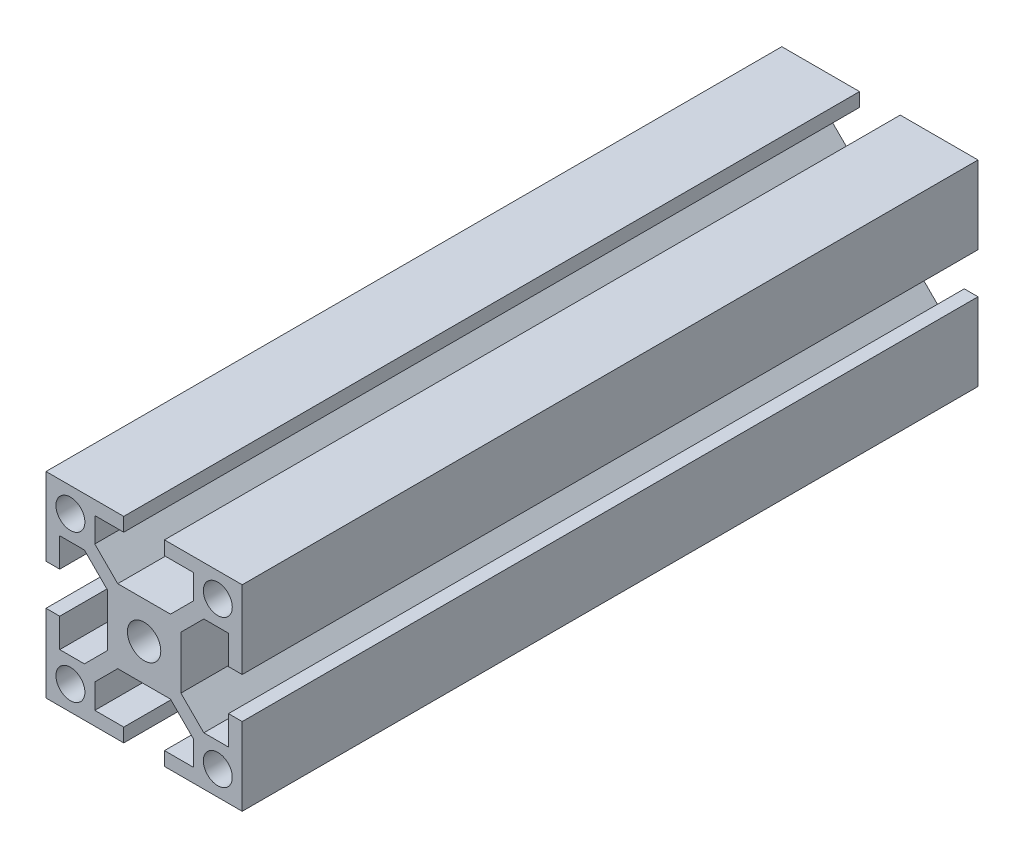
from build123d import *

# Parameters (mm, degrees)
SKETCH_1_R      = 3.4
SKETCH_1_R_2    = 2.95
EXTRUDE_1_DEPTH = 150


with BuildPart() as part:
    # 草图1 → 凸台-拉伸1 (new body)
    with BuildSketch(Plane.XY):
        Polygon((-13.957768282, -16.079088625), (-3.200408969, -16.079088625), (1.470911375, -20.750408969), (1.470911375, -25.779088625), (-4.429088625, -25.779088625), (-4.429088625, -28.579088625), (11.420911375, -28.579088625), (11.420911375, -12.729088625), (8.620911375, -12.729088625), (8.620911375, -18.629088625), (3.592231718, -18.629088625), (-1.079088625, -13.957768282), (-1.079088625, -3.200408969), (3.592231718, 1.470911375), (8.620911375, 1.470911375), (8.620911375, -4.429088625), (11.420911375, -4.429088625), (11.420911375, 11.420911375), (-4.429088625, 11.420911375), (-4.429088625, 8.620911375), (1.470911375, 8.620911375), (1.470911375, 3.592231718), (-3.200408969, -1.079088625), (-13.957768282, -1.079088625), (-18.629088625, 3.592231718), (-18.629088625, 8.620911375), (-12.729088625, 8.620911375), (-12.729088625, 11.420911375), (-28.579088625, 11.420911375), (-28.579088625, -4.429088625), (-25.779088625, -4.429088625), (-25.779088625, 1.470911375), (-20.750408969, 1.470911375), (-16.079088625, -3.200408969), (-16.079088625, -13.957768282), (-20.750408969, -18.629088625), (-25.779088625, -18.629088625), (-25.779088625, -12.729088625), (-28.579088625, -12.729088625), (-28.579088625, -28.579088625), (-12.729088625, -28.579088625), (-12.729088625, -25.779088625), (-18.629088625, -25.779088625), (-18.629088625, -20.750408969), align=None)
        with Locations((-8.579088625, -8.579088625)):
            Circle(SKETCH_1_R, mode=Mode.SUBTRACT)
        with Locations((6.445911375, 6.445911375)):
            Circle(SKETCH_1_R_2, mode=Mode.SUBTRACT)
        with Locations(Location((-23.604088625, 6.445911375, 0), (0, 0, 180))):
            Circle(SKETCH_1_R_2, mode=Mode.SUBTRACT)
        with Locations((-23.604088625, -23.604088625)):
            Circle(SKETCH_1_R_2, mode=Mode.SUBTRACT)
        with Locations(Location((6.445911375, -23.604088625, 0), (0, 0, 180))):
            Circle(SKETCH_1_R_2, mode=Mode.SUBTRACT)
    extrude(amount=EXTRUDE_1_DEPTH)


solid = part.part
